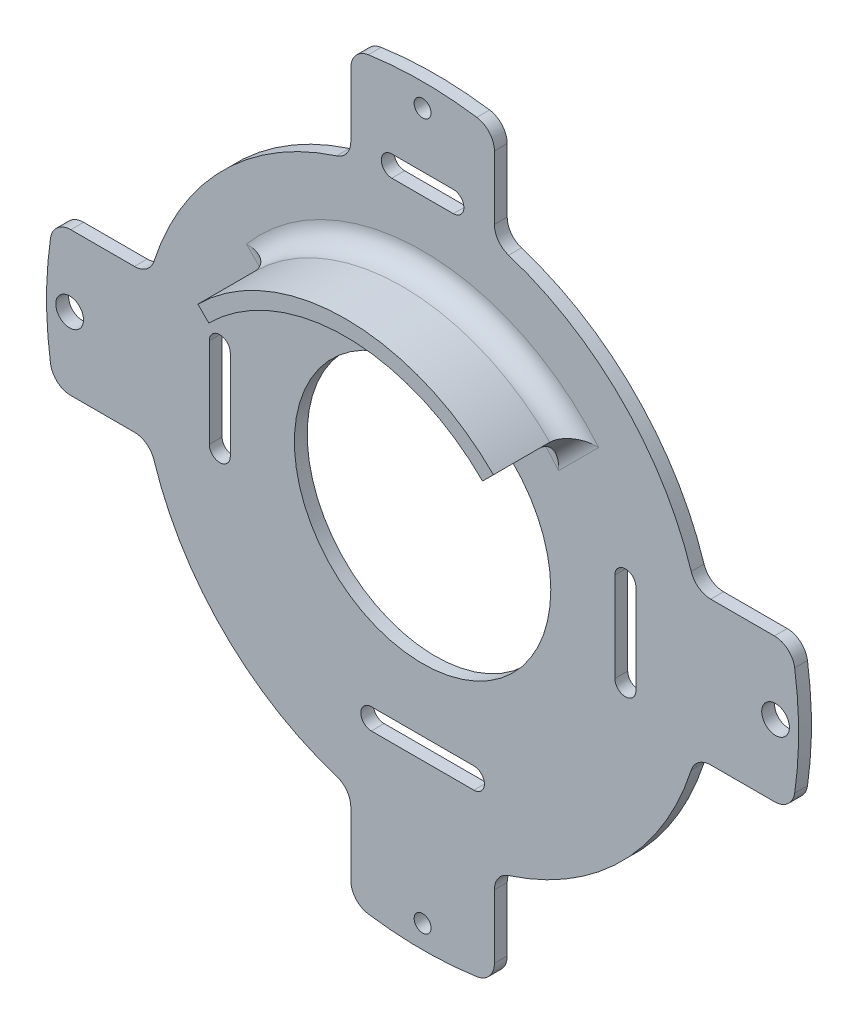
from build123d import *

# Parameters (mm, degrees)
SKETCH1_R           = 73.325
SKETCH1_R_2         = 1.65
SKETCH1_R_3         = 2.7
SKETCH1_R_4         = 25
BOSS_EXTRUDE1_DEPTH = 2.5
BOSS_EXTRUDE2_DEPTH = 15
FILLET2_R           = 4
CUT_EXTRUDE1_DEPTH  = 105.776482333
FILLET1_R           = 4


with BuildPart() as part:
    # Sketch1 → Boss-Extrude1 (new body)
    with BuildSketch(Plane.XY):
        Circle(SKETCH1_R)
        with Locations((0, 68.825)):
            Circle(SKETCH1_R_2, mode=Mode.SUBTRACT)
        with Locations((-68.825, 0)):
            Circle(SKETCH1_R_3, mode=Mode.SUBTRACT)
        Circle(SKETCH1_R_4, mode=Mode.SUBTRACT)
        with Locations((0, -68.825)):
            Circle(SKETCH1_R_2, mode=Mode.SUBTRACT)
        with Locations((68.825, 0)):
            Circle(SKETCH1_R_3, mode=Mode.SUBTRACT)
        with BuildLine():
            Line((-37.5, 8.75), (-37.5, -8.75))
            ThreePointArc((-37.5, -8.75), (-39.55, -10.8), (-41.6, -8.75))
            Line((-41.6, -8.75), (-41.6, 8.75))
            ThreePointArc((-41.6, 8.75), (-39.55, 10.8), (-37.5, 8.75))
        make_face(mode=Mode.SUBTRACT)
        with BuildLine():
            Line((10, -41.35), (-10, -41.35))
            ThreePointArc((-10, -41.35), (-12.05, -39.3), (-10, -37.25))
            Line((-10, -37.25), (10, -37.25))
            ThreePointArc((10, -37.25), (12.05, -39.3), (10, -41.35))
        make_face(mode=Mode.SUBTRACT)
        with BuildLine():
            Line((41.6, -8.75), (41.6, 8.75))
            ThreePointArc((41.6, 8.75), (39.55, 10.8), (37.5, 8.75))
            Line((37.5, 8.75), (37.5, -8.75))
            ThreePointArc((37.5, -8.75), (39.55, -10.8), (41.6, -8.75))
        make_face(mode=Mode.SUBTRACT)
        with BuildLine():
            Line((-6, 58.1), (6, 58.1))
            ThreePointArc((6, 58.1), (8.05, 56.05), (6, 54))
            Line((6, 54), (-6, 54))
            ThreePointArc((-6, 54), (-8.05, 56.05), (-6, 58.1))
        make_face(mode=Mode.SUBTRACT)
    extrude(amount=BOSS_EXTRUDE1_DEPTH)

    # Sketch2 → Boss-Extrude2 (add)
    with BuildSketch(Plane.XY.offset(2.5)):
        with BuildLine():
            Line((-26.69328099, 26.69328099), (-28.814601333, 28.814601333))
            ThreePointArc((-28.814601333, 28.814601333), (0, 40.75), (28.814601333, 28.814601333))
            Line((28.814601333, 28.814601333), (26.69328099, 26.69328099))
            ThreePointArc((26.69328099, 26.69328099), (0, 37.75), (-26.69328099, 26.69328099))
        make_face()
    extrude(amount=BOSS_EXTRUDE2_DEPTH)

    # Fillet2
    fillet2_edges = [part.edges().sort_by_distance(p)[0] for p in [
        (0, 37.75, 2.5),
        (27.753941162, 27.753941162, 2.5),
        (0, 40.75, 2.5),
        (-27.753941162, 27.753941162, 2.5),
    ]]
    fillet(fillet2_edges, radius=FILLET2_R)

    # Sketch4 → Cut-Extrude1 (cut, through all)
    with BuildSketch(Plane.XY.offset(2.5)):
        with BuildLine():
            Line((71.976076755, 14), (53.188344588, 14))
            ThreePointArc((53.188344588, 14), (38.890872965, 38.890872965), (14, 53.188344588))
            Line((14, 53.188344588), (14, 71.976076755))
            ThreePointArc((14, 71.976076755), (51.848604731, 51.848604731), (71.976076755, 14))
        make_face()
        with BuildLine():
            Line((-71.976076755, -14), (-53.188344588, -14))
            ThreePointArc((-53.188344588, -14), (-38.890872965, -38.890872965), (-14, -53.188344588))
            Line((-14, -53.188344588), (-14, -71.976076755))
            ThreePointArc((-14, -71.976076755), (-51.848604731, -51.848604731), (-71.976076755, -14))
        make_face()
        with BuildLine():
            Line((71.976076755, -14), (53.188344588, -14))
            ThreePointArc((53.188344588, -14), (38.890872965, -38.890872965), (14, -53.188344588))
            Line((14, -53.188344588), (14, -71.976076755))
            ThreePointArc((14, -71.976076755), (51.848604731, -51.848604731), (71.976076755, -14))
        make_face()
        with BuildLine():
            Line((-71.976076755, 14), (-53.188344588, 14))
            ThreePointArc((-53.188344588, 14), (-38.890872965, 38.890872965), (-14, 53.188344588))
            Line((-14, 53.188344588), (-14, 71.976076755))
            ThreePointArc((-14, 71.976076755), (-51.848604731, 51.848604731), (-71.976076755, 14))
        make_face()
    extrude(amount=-CUT_EXTRUDE1_DEPTH, mode=Mode.SUBTRACT)

    # Fillet1
    fillet1_edges = [part.edges().sort_by_distance(p)[0] for p in [
        (-14, 53.188344588, 1.25),
        (-53.188344588, 14, 1.25),
        (-71.976076755, 14, 1.25),
        (-14, 71.976076755, 1.25),
        (14, 71.976076755, 1.25),
        (71.976076755, 14, 1.25),
        (53.188344588, 14, 1.25),
        (14, 53.188344588, 1.25),
        (14, -53.188344588, 1.25),
        (53.188344588, -14, 1.25),
        (71.976076755, -14, 1.25),
        (14, -71.976076755, 1.25),
        (-14, -71.976076755, 1.25),
        (-71.976076755, -14, 1.25),
        (-53.188344588, -14, 1.25),
        (-14, -53.188344588, 1.25),
    ]]
    fillet(fillet1_edges, radius=FILLET1_R)


solid = part.part
